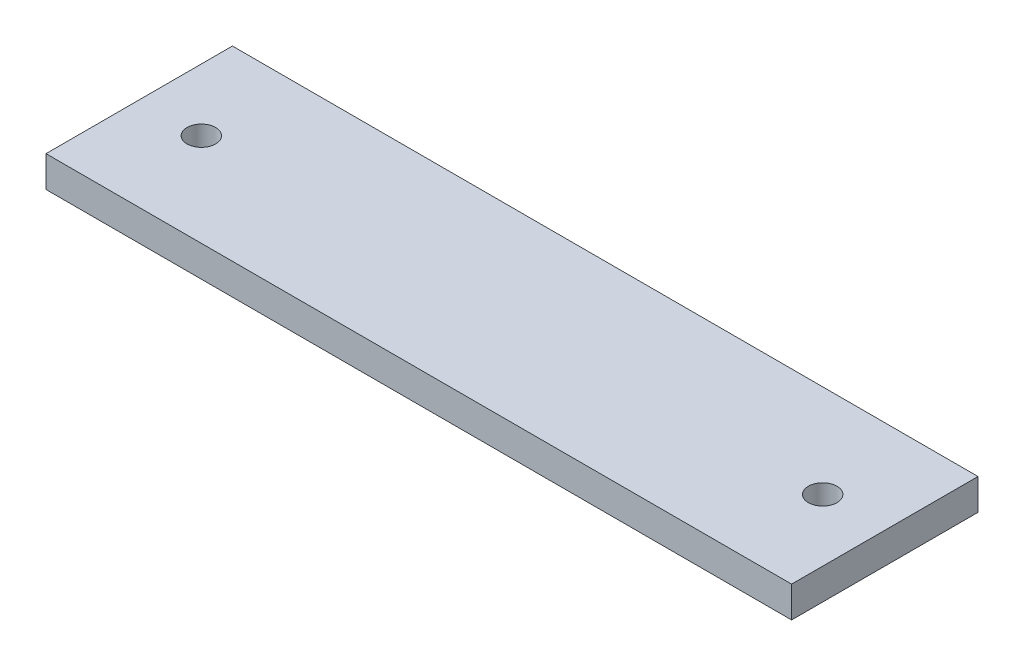
from build123d import *

# Parameters (mm, degrees)
SKETCH1_W           = 76.2
SKETCH1_H           = 19.05
SKETCH1_R           = 1.4605
BOSS_EXTRUDE1_DEPTH = 3.175


with BuildPart() as part:
    # Sketch1 → Boss-Extrude1 (new body)
    with BuildSketch(Plane(origin=(0, 0, 0), x_dir=(1, 0, 0), z_dir=(0, 1, 0))):
        with Locations((38.1, 9.525)):
            Rectangle(SKETCH1_W, SKETCH1_H)
        with Locations(Location((6.35, 9.525, 0), (0, 0, 270))):
            Circle(SKETCH1_R, mode=Mode.SUBTRACT)
        with Locations(Location((69.85, 9.525, 0), (0, 0, 270))):
            Circle(SKETCH1_R, mode=Mode.SUBTRACT)
    extrude(amount=BOSS_EXTRUDE1_DEPTH)


solid = part.part
